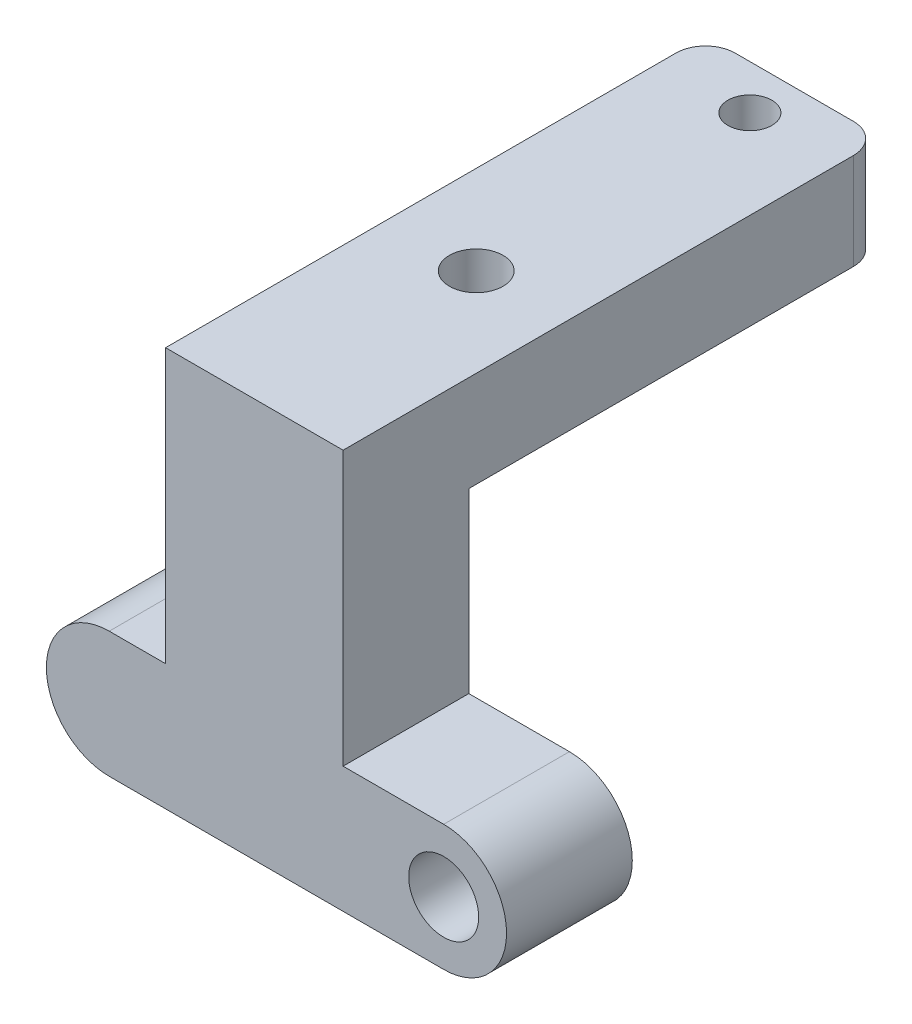
from build123d import *

# Parameters (mm, degrees)
SKETCH_1_R          = 2.365979381
EXTRUDE_1_DEPTH     = 8.5
SKETCH_3_W          = 12
SKETCH_3_H          = 6.5
EXTRUDE_3_DEPTH     = 36.5
SKETCH_4_R          = 1.483814058
SKETCH_4_R_2        = 1.813860949
CUT_EXTRUDE_1_DEPTH = 49.146499311
FILLET_1_R          = 2


with BuildPart() as part:
    # 草圖1 → 填料-伸長1 (new body)
    with BuildSketch(Plane.XY):
        with BuildLine():
            Line((10.832162564, -4.25), (-11.776084859, -4.25))
            ThreePointArc((-11.776084859, -4.25), (-16.026084859, 0), (-11.776084859, 4.25))
            Line((-11.776084859, 4.25), (-7.967837436, 4.25))
            Line((-7.967837436, 4.25), (-7.967837436, 16.25))
            Line((-7.967837436, 16.25), (4.032162564, 16.25))
            Line((4.032162564, 16.25), (4.032162564, 4.25))
            Line((4.032162564, 4.25), (10.832162564, 4.25))
            ThreePointArc((10.832162564, 4.25), (15.082162564, 0), (10.832162564, -4.25))
        make_face()
        with Locations((10.832162564, 0)):
            Circle(SKETCH_1_R, mode=Mode.SUBTRACT)
    extrude(amount=-EXTRUDE_1_DEPTH)

    # 草圖3 → 填料-伸長3 (add)
    with BuildSketch(Plane.XY):
        with Locations((-1.967837436, 19.5)):
            Rectangle(SKETCH_3_W, SKETCH_3_H)
    extrude(amount=-EXTRUDE_3_DEPTH)

    # 草圖4 → 除料-伸長1 (cut, through all)
    with BuildSketch(Plane(origin=(0, 22.75, 0), x_dir=(1, 0, 0), z_dir=(0, 1, 0))):
        with Locations(Location((-1.967837436, 33.5, 0), (0, 0, 270))):
            Circle(SKETCH_4_R)
        with Locations(Location((-1.967837436, 15, 0), (0, 0, 270))):
            Circle(SKETCH_4_R_2)
    extrude(amount=-CUT_EXTRUDE_1_DEPTH, mode=Mode.SUBTRACT)

    # 圓角1
    fillet_1_edges = [part.edges().sort_by_distance(p)[0] for p in [
        (-7.967837436, 19.5, -36.5),
        (4.032162564, 19.5, -36.5),
    ]]
    fillet(fillet_1_edges, radius=FILLET_1_R)


solid = part.part
